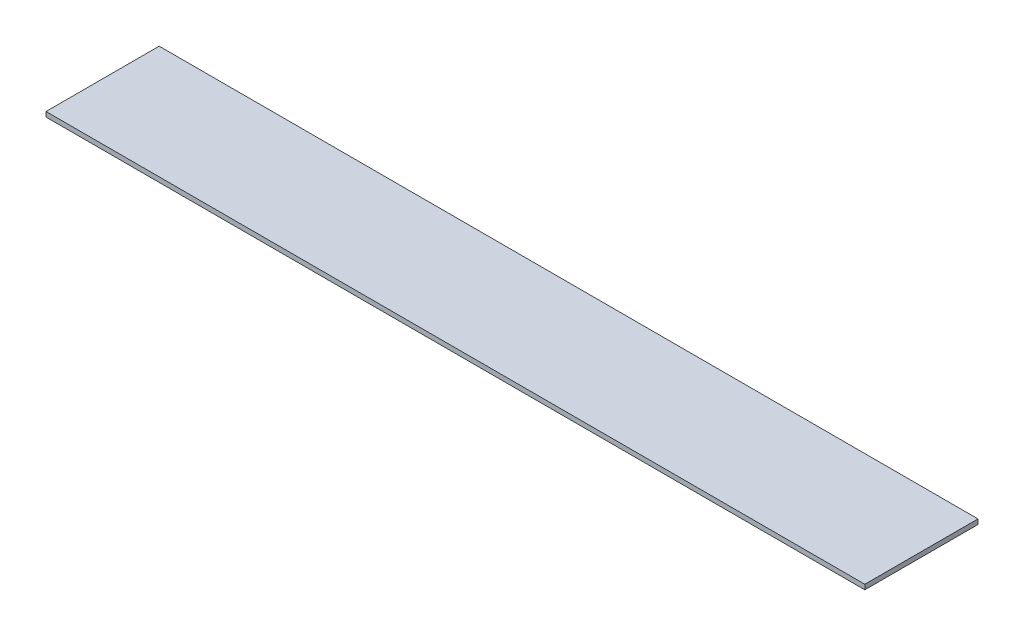
from build123d import *

# Parameters (mm, degrees)
CROQUIS1_W     = 506.5
CROQUIS1_H     = 70
EXTRUIR1_DEPTH = 3


with BuildPart() as part:
    # Croquis1 → Extruir1 (new body)
    with BuildSketch(Plane(origin=(0, 0, 0), x_dir=(1, 0, 0), z_dir=(0, 1, 0))):
        Rectangle(CROQUIS1_W, CROQUIS1_H)
    extrude(amount=EXTRUIR1_DEPTH)


solid = part.part
